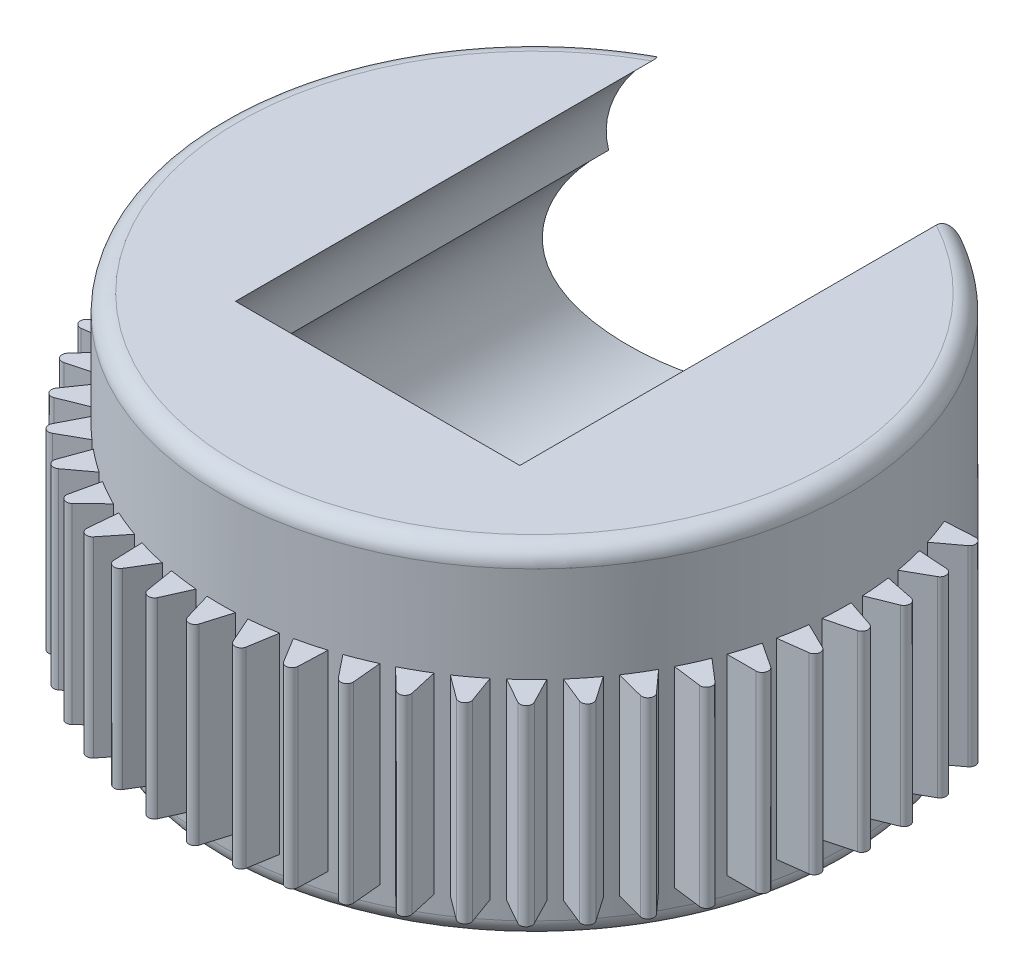
from build123d import *

# Parameters (mm, degrees)
SKETCH_1_R               = 18
EXTRUDE_1_DEPTH          = 19.5
SKETCH_2_R               = 4.5
CUT_EXTRUDE_1_DEPTH      = 33.06633749
CUT_EXTRUDE_2_DEPTH      = 9
CUT_EXTRUDE_2_DEPTH_BACK = 33.06633749
EXTRUDE_2_DEPTH          = 11
PATTERN_CIRCULAR_1_COUNT = 16
PATTERN_CIRCULAR_1_ANGLE = 110
PATTERN_CIRCULAR_2_COUNT = 16
PATTERN_CIRCULAR_2_ANGLE = 110
FILLET_1_R               = 1
FILLET_2_R               = 1
EXTRUDE_3_DEPTH          = 0.3
CHAMFER_1_SIZE           = 2.5


with BuildPart() as part:
    # Эскиз1 → Бобышка-Вытянуть1 (new body)
    with BuildSketch(Plane(origin=(0, 0, 0), x_dir=(1, 0, 0), z_dir=(0, 1, 0))):
        Circle(SKETCH_1_R)
    extrude(amount=EXTRUDE_1_DEPTH)

    # Эскиз2 → Вырез-Вытянуть1 (cut, through all)
    with BuildSketch(Plane(origin=(0, 19.5, 0), x_dir=(1, 0, 0), z_dir=(0, 1, 0))):
        Circle(SKETCH_2_R)
    extrude(amount=-CUT_EXTRUDE_1_DEPTH, mode=Mode.SUBTRACT)

    # Эскиз3 → Вырез-Вытянуть2 (cut, two sides: drawn at the far end of the back side and taken through both)
    with BuildSketch(Plane.XY.offset(-CUT_EXTRUDE_2_DEPTH_BACK)):
        with BuildLine():
            Line((-6.5, 3.5), (6.5, 3.5))
            ThreePointArc((6.5, 3.5), (12.12461108, 7.411040881), (10.416527535, 14.0454166))
            ThreePointArc((10.416527535, 14.0454166), (9.213087271, 18.535519149), (5, 20.5))
            Line((5, 20.5), (-5, 20.5))
            ThreePointArc((-5, 20.5), (-9.213087271, 18.535519149), (-10.416527535, 14.0454166))
            ThreePointArc((-10.416527535, 14.0454166), (-12.12461108, 7.411040881), (-6.5, 3.5))
        make_face()
    extrude(amount=CUT_EXTRUDE_2_DEPTH + CUT_EXTRUDE_2_DEPTH_BACK, mode=Mode.SUBTRACT)

    # Эскиз4 → Бобышка-Вытянуть2 (add)
    with BuildSketch(Plane(origin=(0, 2, 0), x_dir=(-1, 0, 0), z_dir=(0, -1, 0))):
        with BuildLine():
            Line((0.9, -17.7), (0.3352392, -19.582536001))
            ThreePointArc((0.3352392, -19.582536001), (0, -19.831964241), (-0.3352392, -19.582536001))
            Line((-0.3352392, -19.582536001), (-0.9, -17.7))
            Line((-0.9, -17.7), (0.9, -17.7))
        make_face()
    extrude_2 = extrude(amount=-EXTRUDE_2_DEPTH)

    # Круговой массив1: Бобышка-Вытянуть2 ×16 about axis
    pattern_circular_1_axis = Axis((0, 19.5, 0), (0, -1, 0))
    for i in range(1, PATTERN_CIRCULAR_1_COUNT):
        add(extrude_2.rotate(pattern_circular_1_axis, i * PATTERN_CIRCULAR_1_ANGLE / (PATTERN_CIRCULAR_1_COUNT - 1)))

    # Круговой массив2: Бобышка-Вытянуть2 ×16 about axis
    pattern_circular_2_axis = Axis((0, 19.5, 0), (0, 1, 0))
    for i in range(1, PATTERN_CIRCULAR_2_COUNT):
        add(extrude_2.rotate(pattern_circular_2_axis, i * PATTERN_CIRCULAR_2_ANGLE / (PATTERN_CIRCULAR_2_COUNT - 1)))

    # Скругление1
    fillet_1_edges = [part.edges().sort_by_distance(p)[0] for p in [
        (-18, 0, 0),
    ]]
    fillet(fillet_1_edges, radius=FILLET_1_R)

    # Скругление2
    fillet_2_edges = [part.edges().sort_by_distance(p)[0] for p in [
        (-9.409543084, 19.5, 15.344722185),
    ]]
    fillet(fillet_2_edges, radius=FILLET_2_R)

    # Эскиз5 → Бобышка-Вытянуть3 (add)
    with BuildSketch(Plane.XZ):
        Polygon((0.75, 13.357037844), (-0.75, 13.357037844), (0, 15.357037844), align=None)
    extrude(amount=EXTRUDE_3_DEPTH)

    # Фаска1
    chamfer_1_edges = [part.edges().sort_by_distance(p)[0] for p in [
        (-4.5, 0, 0),
    ]]
    chamfer(chamfer_1_edges, length=CHAMFER_1_SIZE)


solid = part.part
